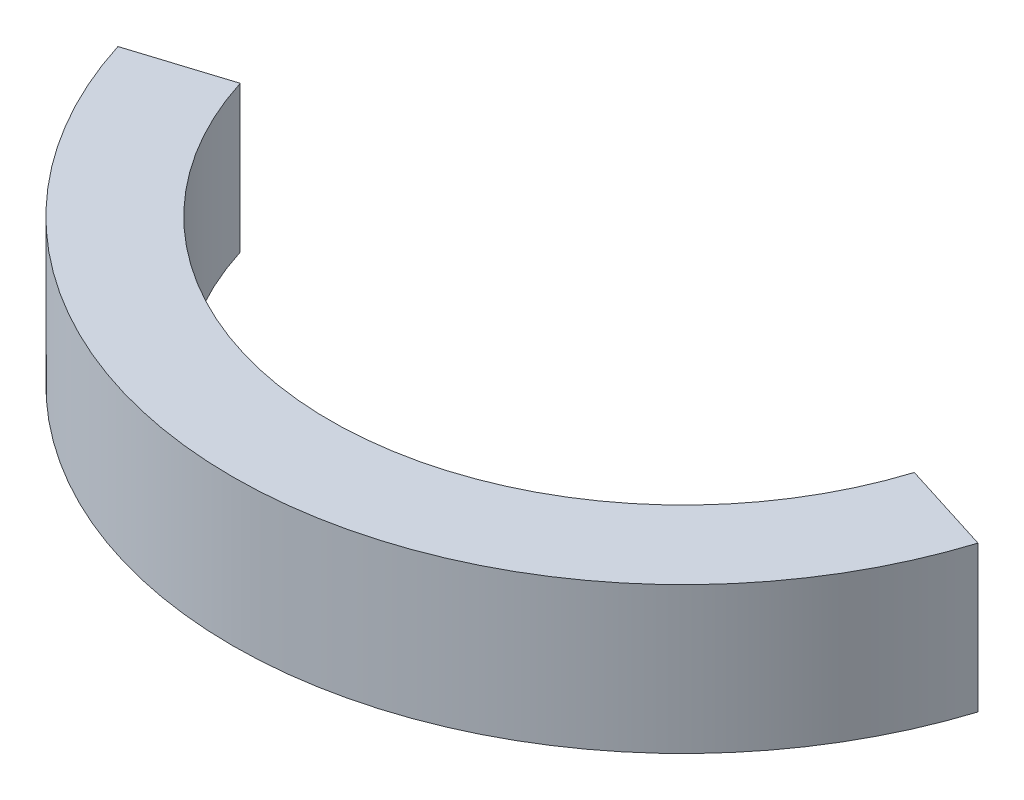
from build123d import *

# Parameters (mm, degrees)
BOSS_EXTRUDE1_DEPTH = 38.1


with BuildPart() as part:
    # Sketch1 → Boss-Extrude1 (new body)
    with BuildSketch(Plane(origin=(0, 0, 0), x_dir=(1, 0, 0), z_dir=(0, 1, 0))):
        with BuildLine():
            Line((-112.037898789, -35.325413797), (-87.81348824, -27.687486489))
            ThreePointArc((-87.81348824, -27.687486489), (0, -92.075), (87.81348824, -27.687486489))
            Line((87.81348824, -27.687486489), (112.037898789, -35.325413797))
            ThreePointArc((112.037898789, -35.325413797), (0, -117.475), (-112.037898789, -35.325413797))
        make_face()
    extrude(amount=-BOSS_EXTRUDE1_DEPTH)


solid = part.part
